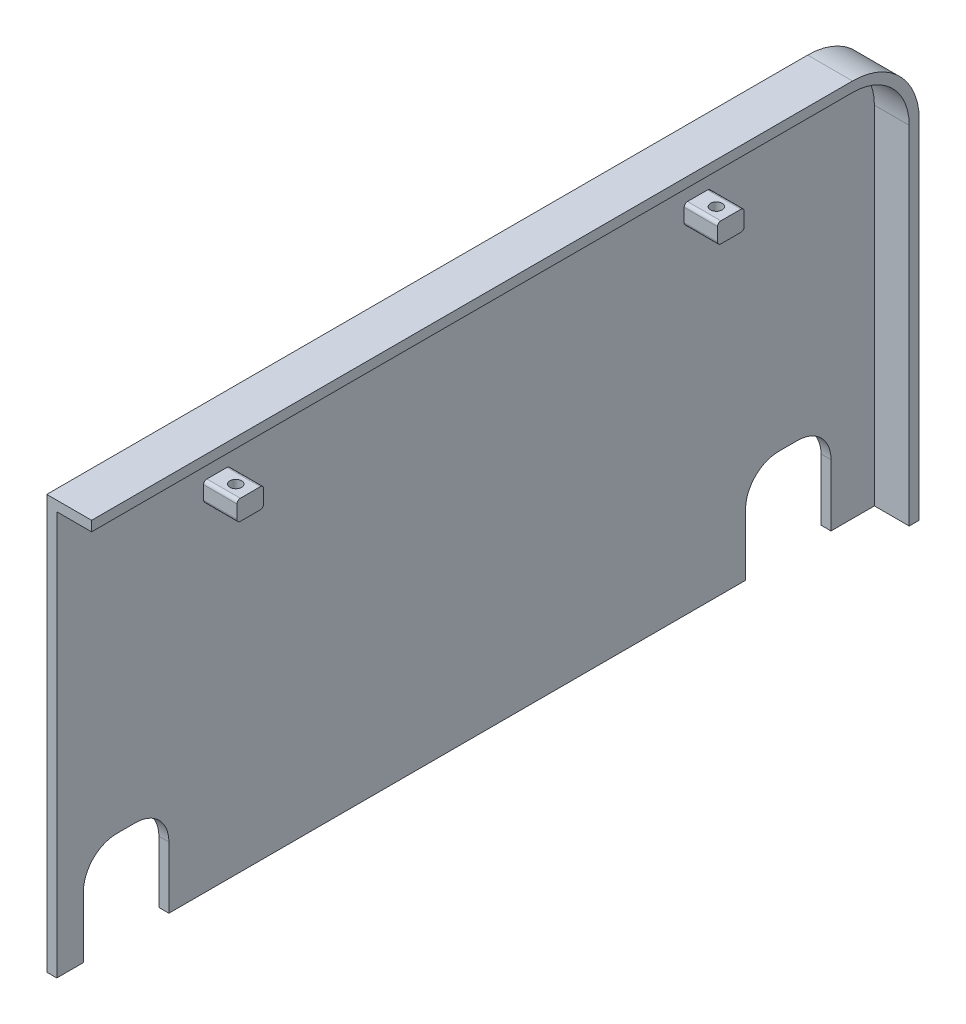
from build123d import *

# Parameters (mm, degrees)
SKETCH1_R             = 10
BOSS_EXTRUDE1_DEPTH   = 3
BOSS_EXTRUDE2_DEPTH   = 10
BOSS_EXTRUDE2_2_DEPTH = 10
BOSS_EXTRUDE3_DEPTH   = 3
SKETCH6_W             = 3
SKETCH6_H             = 253
BOSS_EXTRUDE4_DEPTH   = 159
BOSS_EXTRUDE6_DEPTH   = 10
SKETCH9_R             = 1.735
CUT_EXTRUDE3_DEPTH    = 10
BOSS_EXTRUDE7_DEPTH   = 80.27650967
CUT_EXTRUDE6_DEPTH    = 143
SKETCH14_W            = 253
SKETCH14_H            = 35
CUT_EXTRUDE7_DEPTH    = 143
CUT_EXTRUDE8_DEPTH    = 143
SKETCH17_R            = 2.5
CUT_EXTRUDE9_DEPTH    = 143
SKETCH18_W            = 12.581611653
SKETCH18_H            = 132.027792725
CUT_EXTRUDE10_DEPTH   = 143
SKETCH29_W            = 88.113599476
SKETCH29_H            = 135.236918358
CUT_EXTRUDE19_DEPTH   = 150


with BuildPart() as part:
    # Sketch1 → Boss-Extrude1 (new body)
    with BuildSketch(Plane(origin=(0, 0, 0), x_dir=(0, 0, -1), z_dir=(1, 0, 0))):
        with BuildLine():
            Line((-77.887006237, -82.154885655), (77.912993763, -82.154885655))
            Line((77.912993763, -82.154885655), (77.912993763, -78.154885655))
            ThreePointArc((77.912993763, -78.154885655), (86.412993763, -69.654885655), (94.912993763, -78.154885655))
            Line((94.912993763, -78.154885655), (94.912993763, -82.154885655))
            Line((94.912993763, -82.154885655), (125.012993763, -82.154885655))
            Line((125.012993763, -82.154885655), (125.012993763, 51.845114345))
            Line((125.012993763, 51.845114345), (-124.987006237, 51.845114345))
            Line((-124.987006237, 51.845114345), (-124.987006237, -82.154885655))
            Line((-124.987006237, -82.154885655), (-94.887006237, -82.154885655))
            Line((-94.887006237, -82.154885655), (-94.887006237, -78.154885655))
            ThreePointArc((-94.887006237, -78.154885655), (-86.387006237, -69.654885655), (-77.887006237, -78.154885655))
            Line((-77.887006237, -78.154885655), (-77.887006237, -82.154885655))
        make_face()
        with Locations((-101.987006237, -28.654885655)):
            Circle(SKETCH1_R, mode=Mode.SUBTRACT)
        with Locations(Location((102.012993763, -28.654885655, 0), (0, 0, 180))):
            Circle(SKETCH1_R, mode=Mode.SUBTRACT)
    extrude(amount=-BOSS_EXTRUDE1_DEPTH)

    # Sketch5 → Boss-Extrude3 (add)
    with BuildSketch(Plane(origin=(0, 0, 0), x_dir=(0, 0, -1), z_dir=(1, 0, 0))):
        with BuildLine():
            Line((-124.987006237, 76.845114345), (-124.987006237, 51.845114345))
            Line((-124.987006237, 51.845114345), (125.012993763, 51.845114345))
            Line((125.012993763, 51.845114345), (125.012993763, -82.154885655))
            Line((125.012993763, -82.154885655), (128.012993763, -82.154885655))
            Line((128.012993763, -82.154885655), (128.012993763, 56.845114345))
            ThreePointArc((128.012993763, 56.845114345), (122.155129387, 70.987249969), (108.012993763, 76.845114345))
            Line((108.012993763, 76.845114345), (-124.987006237, 76.845114345))
        make_face()
    extrude(amount=-BOSS_EXTRUDE3_DEPTH)



with BuildPart() as body_2:
    # Sketch2 → Boss-Extrude2 (new body)
    with BuildSketch(Plane.ZY.offset(3)):
        with BuildLine():
            Line((-75.012993763, 59.845114345), (-69.012993763, 59.845114345))
            ThreePointArc((-69.012993763, 59.845114345), (-68.305886982, 59.552221126), (-68.012993763, 58.845114345))
            Line((-68.012993763, 58.845114345), (-68.012993763, 54.845114345))
            ThreePointArc((-68.012993763, 54.845114345), (-68.305886982, 54.138007564), (-69.012993763, 53.845114345))
            Line((-69.012993763, 53.845114345), (-75.012993763, 53.845114345))
            ThreePointArc((-75.012993763, 53.845114345), (-75.720100544, 54.138007564), (-76.012993763, 54.845114345))
            Line((-76.012993763, 54.845114345), (-76.012993763, 58.845114345))
            ThreePointArc((-76.012993763, 58.845114345), (-75.720100544, 59.552221126), (-75.012993763, 59.845114345))
        make_face()
    extrude(amount=BOSS_EXTRUDE2_DEPTH)


with BuildPart() as body_3:
    # Sketch2 → Boss-Extrude2 2 (new body)
    with BuildSketch(Plane.ZY.offset(3)):
        with BuildLine():
            Line((67.987006237, 58.845114345), (67.987006237, 54.845114345))
            ThreePointArc((67.987006237, 54.845114345), (68.279899456, 54.138007564), (68.987006237, 53.845114345))
            Line((68.987006237, 53.845114345), (74.987006237, 53.845114345))
            ThreePointArc((74.987006237, 53.845114345), (75.694113018, 54.138007564), (75.987006237, 54.845114345))
            Line((75.987006237, 54.845114345), (75.987006237, 58.845114345))
            ThreePointArc((75.987006237, 58.845114345), (75.694113018, 59.552221126), (74.987006237, 59.845114345))
            Line((74.987006237, 59.845114345), (68.987006237, 59.845114345))
            ThreePointArc((68.987006237, 59.845114345), (68.279899456, 59.552221126), (67.987006237, 58.845114345))
        make_face()
    extrude(amount=BOSS_EXTRUDE2_2_DEPTH)


with BuildPart() as body_4:
    # Sketch6 → Boss-Extrude4 (new body)
    with BuildSketch(Plane(origin=(0, 76.845114345, 0), x_dir=(1, 0, 0), z_dir=(0, 1, 0))):
        with Locations((-84.77650967, 1.512993763)):
            Rectangle(SKETCH6_W, SKETCH6_H)
    extrude(amount=-BOSS_EXTRUDE4_DEPTH)

    # Sketch8 → Boss-Extrude6 (add)
    with BuildSketch(Plane.ZY.offset(83.27650967)):
        with BuildLine():
            Line((-75.012993763, 59.845114345), (-69.012993763, 59.845114345))
            ThreePointArc((-69.012993763, 59.845114345), (-68.305886982, 59.552221126), (-68.012993763, 58.845114345))
            Line((-68.012993763, 58.845114345), (-68.012993763, 54.845114345))
            ThreePointArc((-68.012993763, 54.845114345), (-68.305886982, 54.138007564), (-69.012993763, 53.845114345))
            Line((-69.012993763, 53.845114345), (-75.012993763, 53.845114345))
            ThreePointArc((-75.012993763, 53.845114345), (-75.720100544, 54.138007564), (-76.012993763, 54.845114345))
            Line((-76.012993763, 54.845114345), (-76.012993763, 58.845114345))
            ThreePointArc((-76.012993763, 58.845114345), (-75.720100544, 59.552221126), (-75.012993763, 59.845114345))
        make_face()
        with BuildLine():
            Line((68.987006237, 59.845114345), (74.987006237, 59.845114345))
            ThreePointArc((74.987006237, 59.845114345), (75.694113018, 59.552221126), (75.987006237, 58.845114345))
            Line((75.987006237, 58.845114345), (75.987006237, 54.845114345))
            ThreePointArc((75.987006237, 54.845114345), (75.694113018, 54.138007564), (74.987006237, 53.845114345))
            Line((74.987006237, 53.845114345), (68.987006237, 53.845114345))
            ThreePointArc((68.987006237, 53.845114345), (68.279899456, 54.138007564), (67.987006237, 54.845114345))
            Line((67.987006237, 54.845114345), (67.987006237, 58.845114345))
            ThreePointArc((67.987006237, 58.845114345), (68.279899456, 59.552221126), (68.987006237, 59.845114345))
        make_face()
    extrude(amount=-BOSS_EXTRUDE6_DEPTH)


with BuildPart() as cut_extrude3_tool:
    # Sketch9 → Cut-Extrude3 (new body)
    with BuildSketch(Plane(origin=(0, 59.845114345, 0), x_dir=(1, 0, 0), z_dir=(0, 1, 0))):
        with Locations(Location((-77.63650967, -71.987006237, 0), (0, 0, 270))):
            Circle(SKETCH9_R)
        with Locations(Location((-77.63650967, 72.012993763, 0), (0, 0, 270))):
            Circle(SKETCH9_R)
        with Locations(Location((-8.64, -71.987006237, 0), (0, 0, 270))):
            Circle(SKETCH9_R)
        with Locations(Location((-8.64, 72.012993763, 0), (0, 0, 270))):
            Circle(SKETCH9_R)
    extrude(amount=-CUT_EXTRUDE3_DEPTH)


with BuildPart() as body_2_1:
    add(body_2.part)

    # Cut-Extrude3: cut by cut_extrude3_tool
    add(cut_extrude3_tool.part, mode=Mode.SUBTRACT)


with BuildPart() as body_3_1:
    add(body_3.part)

    # Cut-Extrude3: cut by cut_extrude3_tool
    add(cut_extrude3_tool.part, mode=Mode.SUBTRACT)


with BuildPart() as body_4_1:
    add(body_4.part)

    # Cut-Extrude3: cut by cut_extrude3_tool
    add(cut_extrude3_tool.part, mode=Mode.SUBTRACT)


with BuildPart() as part_1:
    add(part.part)

    add(body_4_1.part)  # Boss-Extrude7 merges body 4
    # Sketch11 → Boss-Extrude7 (add)
    with BuildSketch(Plane.ZY.offset(3)):
        with BuildLine():
            Line((124.987006237, 73.845114345), (124.987006237, 76.845114345))
            Line((124.987006237, 76.845114345), (-108.012993763, 76.845114345))
            ThreePointArc((-108.012993763, 76.845114345), (-122.155129387, 70.987249969), (-128.012993763, 56.845114345))
            Line((-128.012993763, 56.845114345), (-128.012993763, -82.154885655))
            Line((-128.012993763, -82.154885655), (-125.012993763, -82.154885655))
            Line((-125.012993763, -82.154885655), (-125.012993763, 56.845114345))
            ThreePointArc((-125.012993763, 56.845114345), (-120.033809043, 68.865929625), (-108.012993763, 73.845114345))
            Line((-108.012993763, 73.845114345), (124.987006237, 73.845114345))
        make_face()
    extrude(amount=BOSS_EXTRUDE7_DEPTH)

    # Sketch13 → Cut-Extrude6 (cut)
    with BuildSketch(Plane(origin=(0, 0, 0), x_dir=(0, 0, -1), z_dir=(1, 0, 0))):
        with BuildLine():
            Line((-111.987006237, -28.654885655), (-111.987006237, -82.154885655))
            Line((-111.987006237, -82.154885655), (-77.887006237, -82.154885655))
            Line((-77.887006237, -82.154885655), (-77.887006237, -78.154885655))
            ThreePointArc((-77.887006237, -78.154885655), (-80.376598597, -72.144478015), (-86.387006237, -69.654885655))
            Line((-86.387006237, -69.654885655), (-86.387006237, -28.654885655))
            ThreePointArc((-86.387006237, -28.654885655), (-89.315938425, -21.583817843), (-96.387006237, -18.654885655))
            Line((-96.387006237, -18.654885655), (-101.987006237, -18.654885655))
            ThreePointArc((-101.987006237, -18.654885655), (-109.058074049, -21.583817843), (-111.987006237, -28.654885655))
        make_face()
        with BuildLine():
            Line((112.012993763, -82.154885655), (112.012993763, -28.654885655))
            ThreePointArc((112.012993763, -28.654885655), (109.084061575, -21.583817843), (102.012993763, -18.654885655))
            Line((102.012993763, -18.654885655), (96.412993763, -18.654885655))
            ThreePointArc((96.412993763, -18.654885655), (89.341925951, -21.583817843), (86.412993763, -28.654885655))
            Line((86.412993763, -28.654885655), (86.412993763, -69.654885655))
            ThreePointArc((86.412993763, -69.654885655), (80.402586123, -72.144478015), (77.912993763, -78.154885655))
            Line((77.912993763, -78.154885655), (77.912993763, -82.154885655))
            Line((77.912993763, -82.154885655), (112.012993763, -82.154885655))
        make_face()
    extrude(amount=-CUT_EXTRUDE6_DEPTH, mode=Mode.SUBTRACT)

    # Sketch14 → Cut-Extrude7 (cut)
    with BuildSketch(Plane(origin=(0, 0, 0), x_dir=(0, 0, -1), z_dir=(1, 0, 0))):
        with Locations((1.512993763, -64.654885655)):
            Rectangle(SKETCH14_W, SKETCH14_H)
    extrude(amount=-CUT_EXTRUDE7_DEPTH, mode=Mode.SUBTRACT)

    # Sketch15 → Cut-Extrude8 (cut)
    with BuildSketch(Plane(origin=(0, 0, 0), x_dir=(0, 0, -1), z_dir=(1, 0, 0))):
        with BuildLine():
            Line((108.012993763, 76.845114345), (128.012993763, 76.845114345))
            Line((128.012993763, 76.845114345), (128.012993763, 56.845114345))
            ThreePointArc((128.012993763, 56.845114345), (122.155129387, 70.987249969), (108.012993763, 76.845114345))
        make_face()
    extrude(amount=-CUT_EXTRUDE8_DEPTH, mode=Mode.SUBTRACT)

    # Sketch17 → Cut-Extrude9 (cut)
    with BuildSketch(Plane(origin=(0, 76.845114345, 0), x_dir=(1, 0, 0), z_dir=(0, 1, 0))):
        with Locations(Location((-43.138761, -96.337006347, 0), (0, 0, 270))):
            Circle(SKETCH17_R)
    extrude(amount=-CUT_EXTRUDE9_DEPTH, mode=Mode.SUBTRACT)

    # Sketch18 → Cut-Extrude10 (cut)
    with BuildSketch(Plane(origin=(0, 0, 0), x_dir=(0, 0, -1), z_dir=(1, 0, 0))):
        with Locations((-126.277812064, 15.020453299)):
            Rectangle(SKETCH18_W, SKETCH18_H)
    extrude(amount=-CUT_EXTRUDE10_DEPTH, mode=Mode.SUBTRACT)


with BuildPart() as cut_extrude19_tool:
    # Sketch29 → Cut-Extrude19 (new, symmetric)
    with BuildSketch(Plane.XY):
        with Locations((-28.779229361, 13.195273746)):
            Rectangle(SKETCH29_W, SKETCH29_H)
    extrude(amount=CUT_EXTRUDE19_DEPTH, both=True)


with BuildPart() as part_2:
    add(part_1.part)

    # Cut-Extrude19: cut by cut_extrude19_tool
    add(cut_extrude19_tool.part, mode=Mode.SUBTRACT)


with BuildPart() as body_2_2:
    add(body_2_1.part)

    # Cut-Extrude19: cut by cut_extrude19_tool
    add(cut_extrude19_tool.part, mode=Mode.SUBTRACT)


with BuildPart() as body_3_2:
    add(body_3_1.part)

    # Cut-Extrude19: cut by cut_extrude19_tool
    add(cut_extrude19_tool.part, mode=Mode.SUBTRACT)


solid = part_2.part
